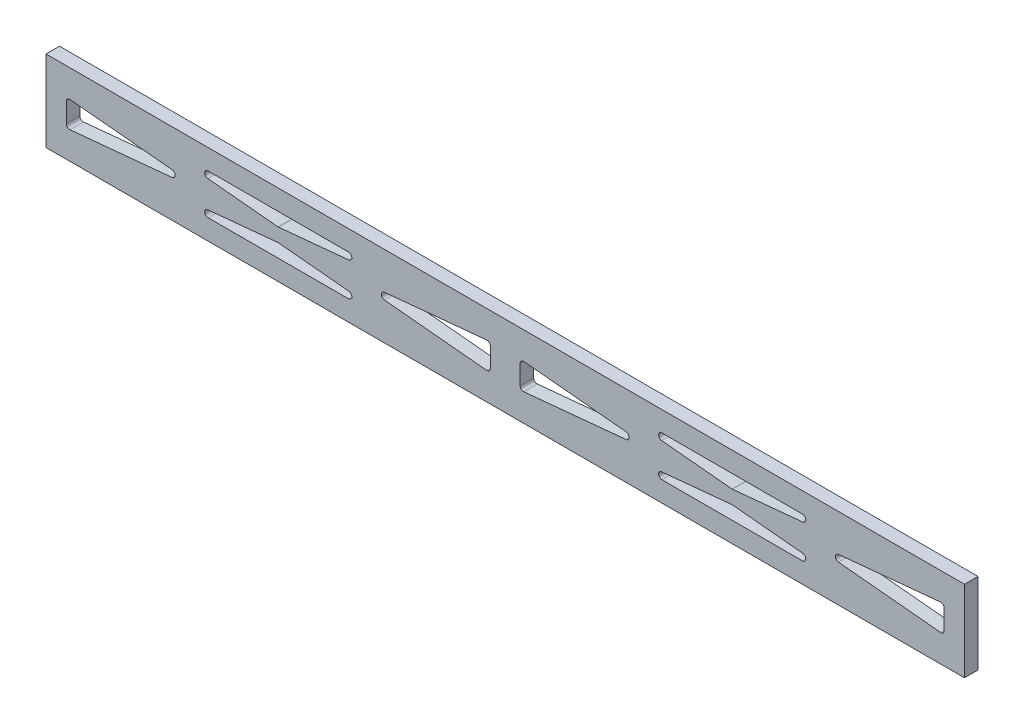
from build123d import *

# Parameters (mm, degrees)
SKETCH1_W           = 431.8
SKETCH1_H           = 38.1
BOSS_EXTRUDE1_DEPTH = 6.35
CUT_EXTRUDE1_DEPTH  = 434.524131393
FILLET1_R           = 1.5875


with BuildPart() as part:
    # Sketch1 → Boss-Extrude1 (new body)
    with BuildSketch(Plane.XY):
        with Locations((215.9, 19.05)):
            Rectangle(SKETCH1_W, SKETCH1_H)
    extrude(amount=BOSS_EXTRUDE1_DEPTH)

    # Sketch3 → Cut-Extrude1 (cut, through all)
    with BuildSketch(Plane.XY.offset(6.35)):
        Polygon((75.827293092, 19.05), (9.525, 25.385537758), (9.525, 12.714462242), align=None)
        Polygon((175.507756818, 28.575), (42.903170633, 28.575), (109.205463726, 22.239462242), align=None)
        Polygon((175.507756818, 9.525), (109.205463726, 15.860537758), (42.903170633, 9.525), align=None)
        Polygon((208.885927451, 25.385537758), (142.583634359, 19.05), (208.885927451, 12.714462242), align=None)
        Polygon((289.216365641, 19.05), (222.914072549, 25.385537758), (222.914072549, 12.714462242), align=None)
        Polygon((388.896829367, 28.575), (256.292243182, 28.575), (322.594536274, 22.239462242), align=None)
        Polygon((322.594536274, 15.860537758), (256.292243182, 9.525), (388.896829367, 9.525), align=None)
        Polygon((422.275, 25.385537758), (355.972706908, 19.05), (422.275, 12.714462242), align=None)
    extrude(amount=-CUT_EXTRUDE1_DEPTH, mode=Mode.SUBTRACT)

    # Fillet1
    fillet1_edges = [part.edges().sort_by_distance(p)[0] for p in [
        (289.216365641, 19.05, 3.175),
        (222.914072549, 12.714462242, 3.175),
        (222.914072549, 25.385537758, 3.175),
        (142.583634359, 19.05, 3.175),
        (208.885927451, 25.385537758, 3.175),
        (208.885927451, 12.714462242, 3.175),
        (42.903170633, 9.525, 3.175),
        (109.205463726, 15.860537758, 3.175),
        (175.507756818, 9.525, 3.175),
        (109.205463726, 22.239462242, 3.175),
        (42.903170633, 28.575, 3.175),
        (175.507756818, 28.575, 3.175),
        (422.275, 25.385537758, 3.175),
        (422.275, 12.714462242, 3.175),
        (355.972706908, 19.05, 3.175),
        (322.594536274, 15.860537758, 3.175),
        (388.896829367, 9.525, 3.175),
        (256.292243182, 9.525, 3.175),
        (388.896829367, 28.575, 3.175),
        (322.594536274, 22.239462242, 3.175),
        (256.292243182, 28.575, 3.175),
        (9.525, 12.714462242, 3.175),
        (9.525, 25.385537758, 3.175),
        (75.827293092, 19.05, 3.175),
    ]]
    fillet(fillet1_edges, radius=FILLET1_R)


solid = part.part
